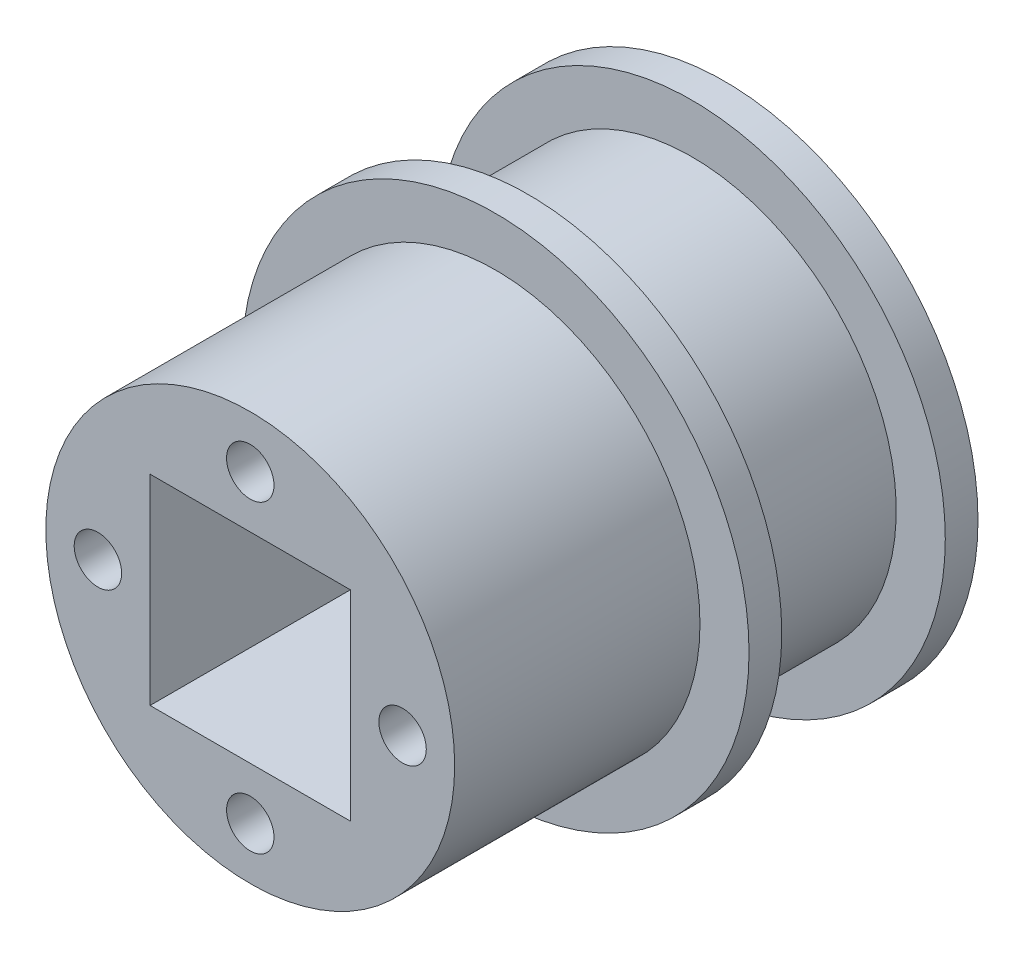
from build123d import *

# Parameters (mm, degrees)
SKETCH1_R           = 12.5
BOSS_EXTRUDE1_DEPTH = 7.5
SKETCH13_R          = 15.5
BOSS_EXTRUDE2_DEPTH = 2
SKETCH14_R          = 12.5
BOSS_EXTRUDE3_DEPTH = 10
SKETCH15_R          = 15.5
BOSS_EXTRUDE4_DEPTH = 2
CUT_EXTRUDE1_REACH  = 38.352
SKETCH8_W           = 12.25
SKETCH8_H           = 12.25
CUT_EXTRUDE4_REACH  = 38.352
SKETCH11_R          = 1.45


with BuildPart() as part:
    # Sketch1 → Boss-Extrude1 (new, symmetric)
    with BuildSketch(Plane.XY):
        Circle(SKETCH1_R)
    extrude(amount=BOSS_EXTRUDE1_DEPTH, both=True)

    # Sketch13 → Boss-Extrude2 (add)
    with BuildSketch(Plane(origin=(0, 0, -7.5), x_dir=(-1, 0, 0), z_dir=(0, 0, -1))):
        Circle(SKETCH13_R)
    extrude(amount=BOSS_EXTRUDE2_DEPTH)

    # Sketch14 → Boss-Extrude3 (add)
    with BuildSketch(Plane(origin=(0, 0, -9.5), x_dir=(-1, 0, 0), z_dir=(0, 0, -1))):
        with Locations(Location((0, 0, 0), (0, 0, 180))):
            Circle(SKETCH14_R)
    extrude(amount=BOSS_EXTRUDE3_DEPTH)

    # Sketch15 → Boss-Extrude4 (add)
    with BuildSketch(Plane(origin=(0, 0, -19.5), x_dir=(-1, 0, 0), z_dir=(0, 0, -1))):
        Circle(SKETCH15_R)
    extrude(amount=BOSS_EXTRUDE4_DEPTH)

    # Sketch8 → Cut-Extrude1 (cut, up to next)
    with BuildSketch(Plane.XY.offset(7.5), mode=Mode.PRIVATE) as cut_extrude1_sk1:
        Rectangle(SKETCH8_W, SKETCH8_H)
    cut_extrude1_tool1 = extrude(cut_extrude1_sk1.sketch, amount=-CUT_EXTRUDE1_REACH, mode=Mode.PRIVATE) & part.part
    add(cut_extrude1_tool1.solids().sort_by_distance((0, 0, 7.5))[0], mode=Mode.SUBTRACT)

    # Sketch11 → Cut-Extrude4 (cut, up to next)
    with BuildSketch(Plane.XY.offset(7.5), mode=Mode.PRIVATE) as cut_extrude4_sk1:
        with Locations((9.315, 0)):
            Circle(SKETCH11_R)
    cut_extrude4_tool1 = extrude(cut_extrude4_sk1.sketch, amount=-CUT_EXTRUDE4_REACH, mode=Mode.PRIVATE) & part.part
    # Sketch11 → Cut-Extrude4 (cut, up to next)
    with BuildSketch(Plane.XY.offset(7.5), mode=Mode.PRIVATE) as cut_extrude4_sk2:
        with Locations((0, -9.315)):
            Circle(SKETCH11_R)
    cut_extrude4_tool2 = extrude(cut_extrude4_sk2.sketch, amount=-CUT_EXTRUDE4_REACH, mode=Mode.PRIVATE) & part.part
    # Sketch11 → Cut-Extrude4 (cut, up to next)
    with BuildSketch(Plane.XY.offset(7.5), mode=Mode.PRIVATE) as cut_extrude4_sk3:
        with Locations((-9.315, 0)):
            Circle(SKETCH11_R)
    cut_extrude4_tool3 = extrude(cut_extrude4_sk3.sketch, amount=-CUT_EXTRUDE4_REACH, mode=Mode.PRIVATE) & part.part
    # Sketch11 → Cut-Extrude4 (cut, up to next)
    with BuildSketch(Plane.XY.offset(7.5), mode=Mode.PRIVATE) as cut_extrude4_sk4:
        with Locations((0, 9.315)):
            Circle(SKETCH11_R)
    cut_extrude4_tool4 = extrude(cut_extrude4_sk4.sketch, amount=-CUT_EXTRUDE4_REACH, mode=Mode.PRIVATE) & part.part
    add(cut_extrude4_tool1.solids().sort_by_distance((9.315, 0, 7.5))[0], mode=Mode.SUBTRACT)
    add(cut_extrude4_tool2.solids().sort_by_distance((0, -9.315, 7.5))[0], mode=Mode.SUBTRACT)
    add(cut_extrude4_tool3.solids().sort_by_distance((-9.315, 0, 7.5))[0], mode=Mode.SUBTRACT)
    add(cut_extrude4_tool4.solids().sort_by_distance((0, 9.315, 7.5))[0], mode=Mode.SUBTRACT)


solid = part.part
